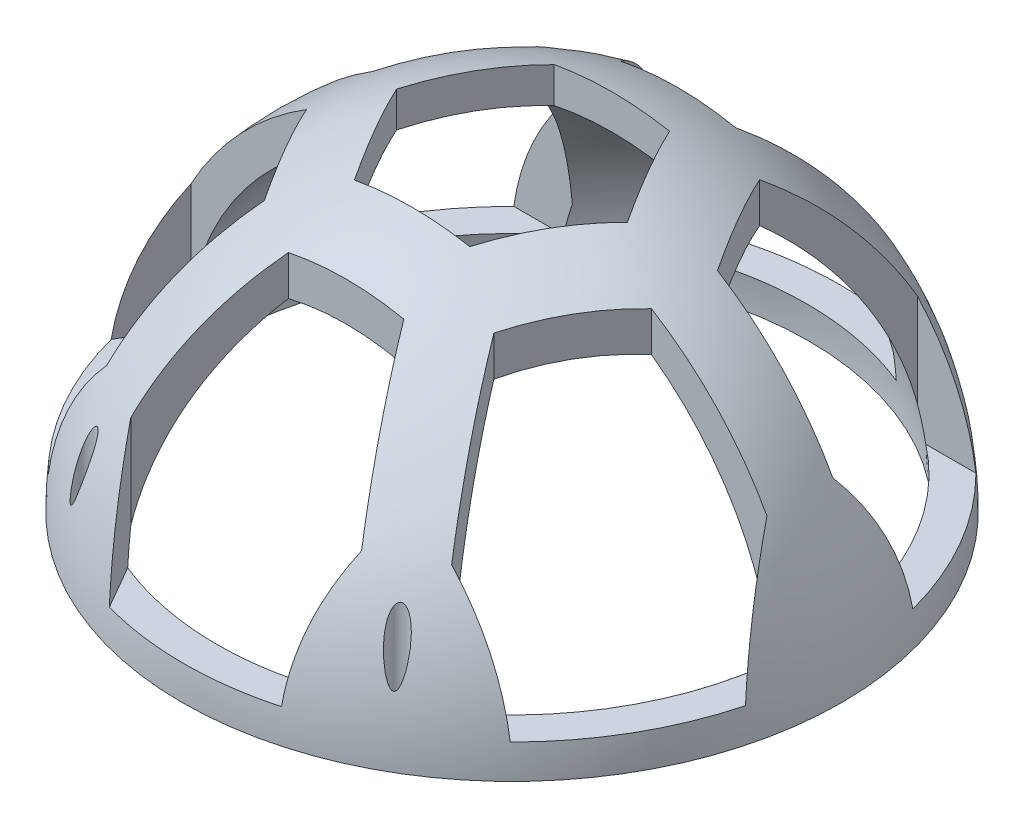
from build123d import *

# Parameters (mm, degrees)
REVOLUCI_N_L_MINA1_ANGLE      = 180
CORTAR_EXTRUIR1_START         = -10
CORTAR_EXTRUIR1_DEPTH         = 100
CORTAR_EXTRUIR2_DEPTH         = 184
CORTAR_EXTRUIR2_DEPTH_BACK    = 4
CROQUIS4_W                    = 20
CROQUIS4_H                    = 10
CORTAR_EXTRUIR3_DEPTH         = 15
CORTAR_EXTRUIR3_DEPTH_BACK    = 30
CROQUIS5_R                    = 3
TALADRO_ROSCADO_M4X0_71_D     = 3.3
TALADRO_ROSCADO_M4X0_71_DEPTH = 8
TALADRO_ROSCADO_M4X0_71_TIP   = 0.991420021


with BuildPart() as part:
    # Croquis1 → Revolución-Lámina1 (revolve)
    with BuildSketch(Plane(origin=(0, 0, 0), x_dir=(1, 0, 0), z_dir=(0, 1, 0))):
        with BuildLine():
            ThreePointArc((0, 100), (100, 0), (0, -100))
            Line((0, -100), (0, -90))
            ThreePointArc((0, -90), (90, 0), (0, 90))
            Line((0, 90), (0, 100))
        make_face()
    revolve(axis=Axis((0, 0, -100), (0, 0, 1)), revolution_arc=REVOLUCI_N_L_MINA1_ANGLE)

    # Croquis2 → Cortar-Extruir1 (cut)
    with BuildSketch(Plane(origin=(0, 0, 0), x_dir=(-1, 0, 0), z_dir=(0, -1, 0)).offset(CORTAR_EXTRUIR1_START)):
        Polygon((17.5, 30.310889132), (-17.5, 30.310889132), (-35, 0), (-17.5, -30.310889132), (17.5, -30.310889132), (35, 0), align=None)
        Polygon((104.820508076, 40.310889132), (87.320508076, 70.621778265), (52.320508076, 70.621778265), (34.820508076, 40.310889132), (52.320508076, 10), (87.320508076, 10), align=None)
        Polygon((17.5, 110.932667397), (-17.5, 110.932667397), (-35, 80.621778265), (-17.5, 50.310889132), (17.5, 50.310889132), (35, 80.621778265), align=None)
        Polygon((87.320508076, -70.621778265), (104.820508076, -40.310889132), (87.320508076, -10), (52.320508076, -10), (34.820508076, -40.310889132), (52.320508076, -70.621778265), align=None)
        Polygon((-17.5, -110.932667397), (17.5, -110.932667397), (35, -80.621778265), (17.5, -50.310889132), (-17.5, -50.310889132), (-35, -80.621778265), align=None)
        Polygon((-104.820508076, -40.310889132), (-87.320508076, -70.621778265), (-52.320508076, -70.621778265), (-34.820508076, -40.310889132), (-52.320508076, -10), (-87.320508076, -10), align=None)
        Polygon((-87.320508076, 70.621778265), (-104.820508076, 40.310889132), (-87.320508076, 10), (-52.320508076, 10), (-34.820508076, 40.310889132), (-52.320508076, 70.621778265), align=None)
    extrude(amount=-CORTAR_EXTRUIR1_DEPTH, mode=Mode.SUBTRACT)

    # Croquis4 → Cortar-Extruir2 (cut, two sides: drawn at the far end of the back side and taken through both)
    with BuildSketch(Plane.ZY.offset(-90).offset(-CORTAR_EXTRUIR2_DEPTH_BACK)):
        Rectangle(CROQUIS4_W, CROQUIS4_H)
    extrude(amount=CORTAR_EXTRUIR2_DEPTH + CORTAR_EXTRUIR2_DEPTH_BACK, mode=Mode.SUBTRACT)

    # Croquis5 → Cortar-Extruir3 (cut, two sides: drawn at the far end of the back side and taken through both)
    with BuildSketch(Plane(origin=(0, 20, 0), x_dir=(-1, 0, 0), z_dir=(0, -1, 0)).offset(-CORTAR_EXTRUIR3_DEPTH_BACK)):
        with Locations(Location((-47.5, 82.27241336, 0), (0, 0, 180))):
            Circle(CROQUIS5_R)
        with Locations(Location((-47.5, -82.27241336, 0), (0, 0, 180))):
            Circle(CROQUIS5_R)
        with Locations(Location((47.5, -82.27241336, 0), (0, 0, 180))):
            Circle(CROQUIS5_R)
        with Locations(Location((47.5, 82.27241336, 0), (0, 0, 180))):
            Circle(CROQUIS5_R)
    extrude(amount=CORTAR_EXTRUIR3_DEPTH + CORTAR_EXTRUIR3_DEPTH_BACK, mode=Mode.SUBTRACT)

    # Taladro roscado M4x0.71
    with Locations(Plane(origin=(47.5, 5, 82.27241336), x_dir=(1, 0, 0), z_dir=(0, 1, 0))):
        with Locations((0, 0), (0, 164.54482672), (-95, 0), (-95, 164.54482672)):
            Hole(TALADRO_ROSCADO_M4X0_71_D / 2, depth=TALADRO_ROSCADO_M4X0_71_DEPTH)
            with Locations((0, 0, -(TALADRO_ROSCADO_M4X0_71_DEPTH + TALADRO_ROSCADO_M4X0_71_TIP / 2))):  # 118° drill point
                Cone(0, TALADRO_ROSCADO_M4X0_71_D / 2, TALADRO_ROSCADO_M4X0_71_TIP, mode=Mode.SUBTRACT)


solid = part.part
